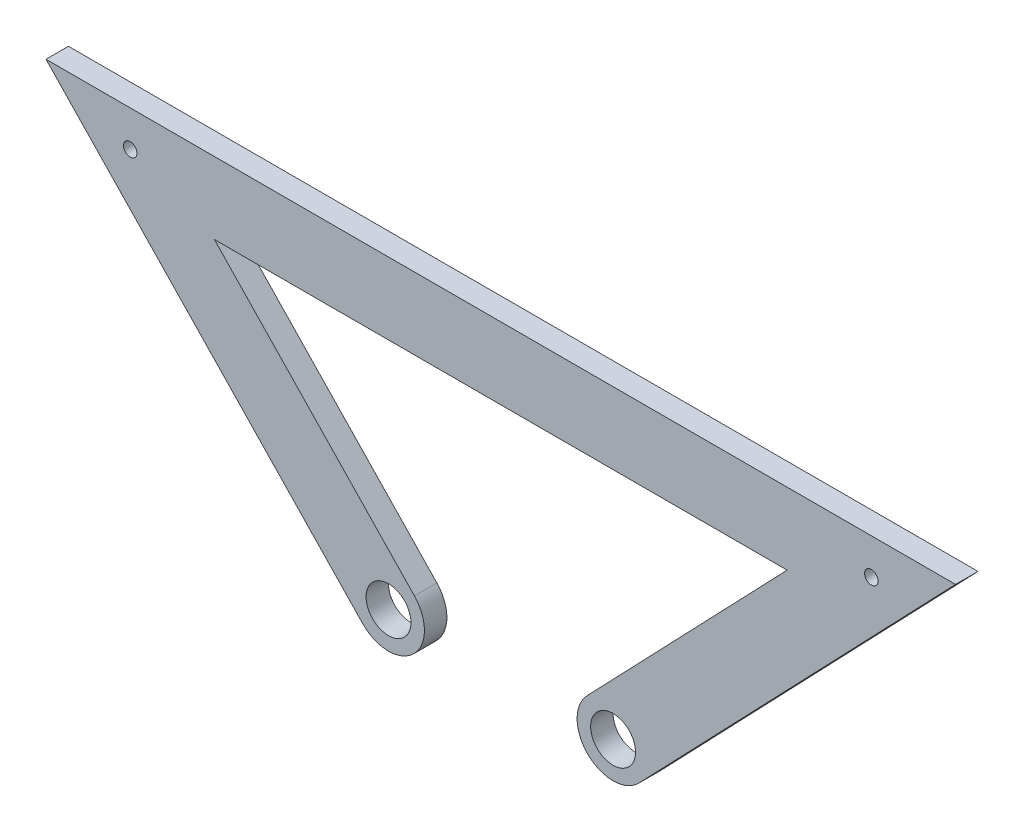
from build123d import *

# Parameters (mm, degrees)
BOSS_EXTRUDE9_DEPTH = 10
SKETCH2_6_R         = 3
SKETCH2_6_R_2       = 10
CUT_EXTRUDE1_DEPTH  = 10
SCALE1_SCALE        = 0.5


with BuildPart() as part:
    # Sketch2 → Boss-Extrude9 (new body)
    with BuildSketch(Plane.XY):
        with BuildLine():
            Line((-127.505639815, 104), (-38.448188718, 11.070485812))
            ThreePointArc((-38.448188718, 11.070485812), (-38.929514188, -11.551811282), (-61.551811282, -11.070485812))
            Line((-61.551811282, -11.070485812), (-202.494360185, 136))
            Line((-202.494360185, 136), (202.494360185, 136))
            Line((202.494360185, 136), (61.551811282, -11.070485812))
            ThreePointArc((61.551811282, -11.070485812), (38.929514188, -11.551811282), (38.448188718, 11.070485812))
            Line((38.448188718, 11.070485812), (127.505639815, 104))
            Line((127.505639815, 104), (-127.505639815, 104))
        make_face()
    extrude(amount=-BOSS_EXTRUDE9_DEPTH)

    # Sketch2<6> → Cut-Extrude1 (cut)
    with BuildSketch(Plane.XY):
        with Locations((-165, 120)):
            Circle(SKETCH2_6_R)
        with Locations((165, 120)):
            Circle(SKETCH2_6_R)
        with Locations((-50, 0)):
            Circle(SKETCH2_6_R_2)
        with Locations((50, 0)):
            Circle(SKETCH2_6_R_2)
    extrude(amount=-CUT_EXTRUDE1_DEPTH, mode=Mode.SUBTRACT)


with BuildPart() as part_1:
    # Scale1: scaled about (0, 89.576748788, -5)
    add(part.part.scale(SCALE1_SCALE).moved(Location((0, 44.788374394, -2.5))))


solid = part_1.part
